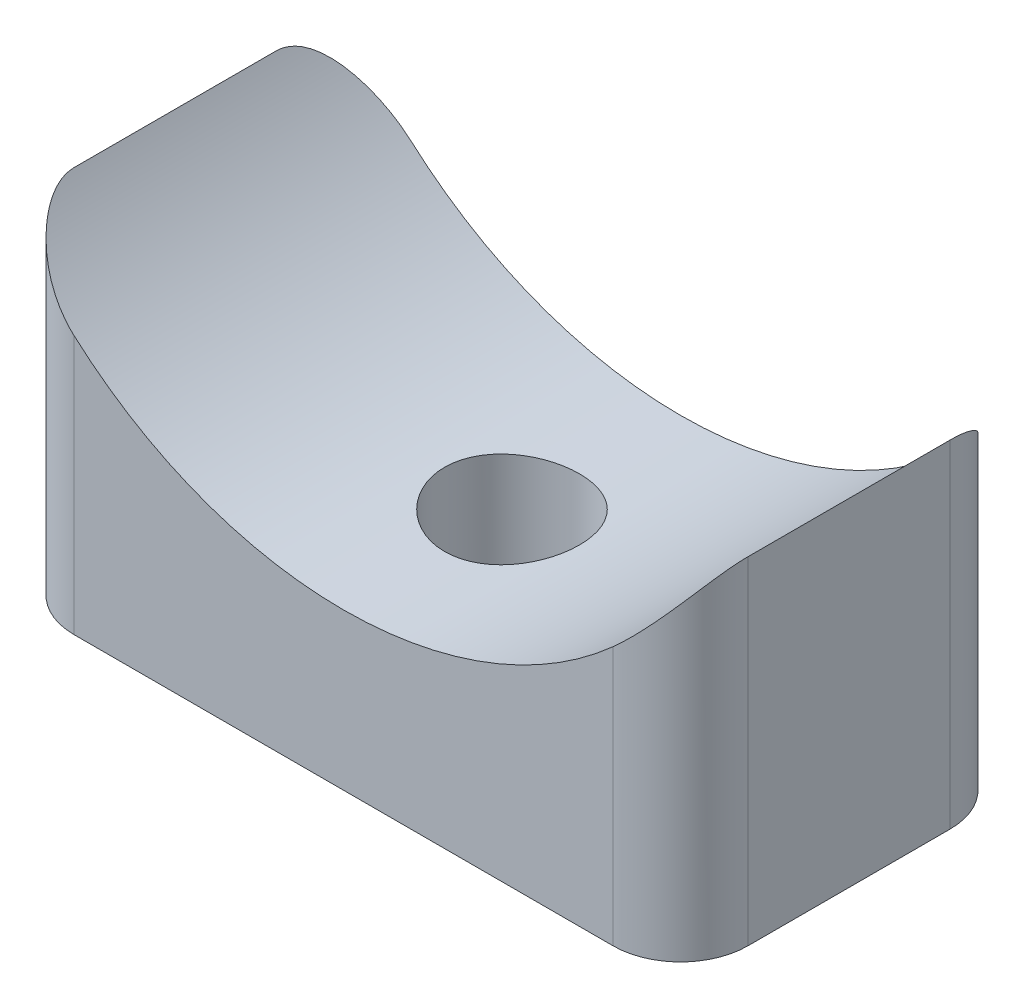
from build123d import *

# Parameters (mm, degrees)
EXTRUDE_1_DEPTH     = 5
SKETCH_2_R          = 2
CUT_EXTRUDE_1_DEPTH = 15
FILLET_1_R          = 2


with BuildPart() as part:
    # 草图1 → 凸台-拉伸1 (new, symmetric)
    with BuildSketch(Plane.XY):
        with BuildLine():
            Line((0, 0), (20, 0))
            Line((20, 0), (20, 10))
            ThreePointArc((20, 10), (10, 4.633249581), (0, 10))
            Line((0, 10), (0, 0))
        make_face()
    extrude(amount=EXTRUDE_1_DEPTH, both=True)

    # 草图2 → 切除-拉伸1 (cut)
    with BuildSketch(Plane(origin=(0, 0, 0), x_dir=(1, 0, 0), z_dir=(0, 1, 0))):
        with Locations(Location((10, 0, 0), (0, 0, 90))):
            Circle(SKETCH_2_R)
    extrude(amount=CUT_EXTRUDE_1_DEPTH, mode=Mode.SUBTRACT)

    # 圆角1
    fillet_1_edges = [part.edges().sort_by_distance(p)[0] for p in [
        (20, 5, 5),
        (0, 5, 5),
        (20, 5, -5),
        (0, 5, -5),
    ]]
    fillet(fillet_1_edges, radius=FILLET_1_R)


solid = part.part
